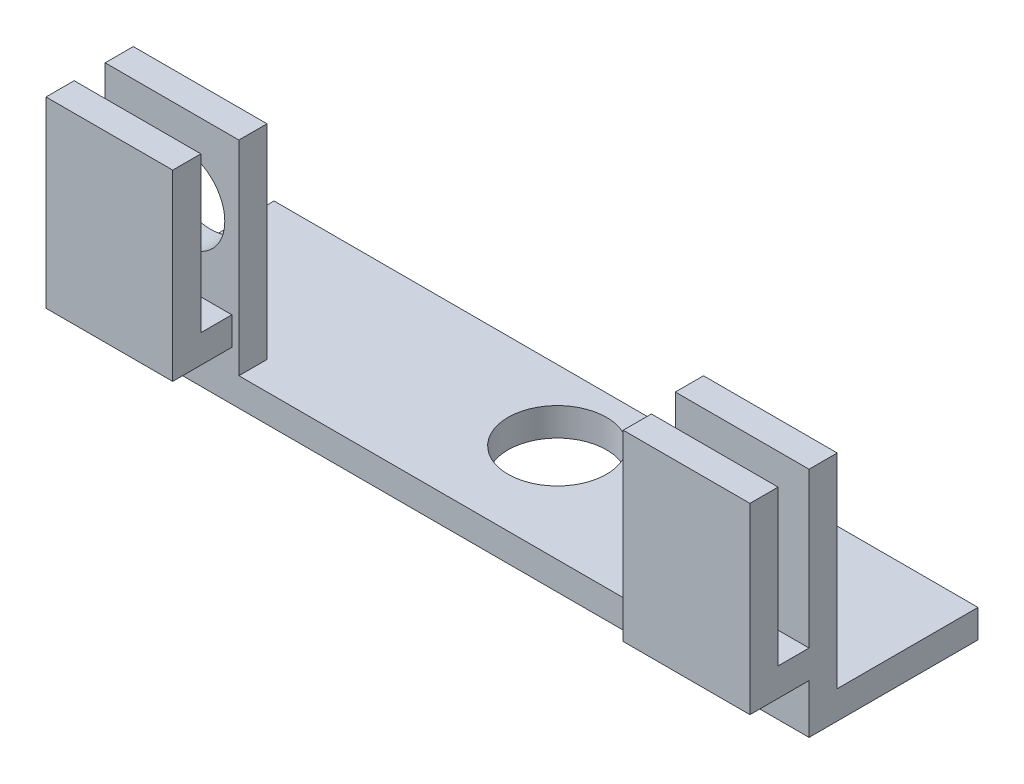
from build123d import *

# Parameters (mm, degrees)
ESBO_O1_R                = 1.5
RESSALTO_EXTRUS_O1_DEPTH = 1
ESBO_O2_W                = 25
ESBO_O2_H                = 1
RESSALTO_EXTRUS_O2_DEPTH = 5
ESBO_O3_R                = 1.75
CORTE_EXTRUS_O1_DEPTH    = 5
ESBO_O4_W                = 4.5
ESBO_O4_H                = 1
RESSALTO_EXTRUS_O3_DEPTH = 1.1
ESBO_O5_W                = 4.5
ESBO_O5_H                = 6.5
RESSALTO_EXTRUS_O4_DEPTH = 1


with BuildPart() as part:
    # Esboço1 → Ressalto-extrusão1 (new body)
    with BuildSketch(Plane.XY):
        Polygon((-2.930659551, 5.581459362), (-2.930659551, -2.668540638), (22.069340449, -2.668540638), (22.069340449, 5.581459362), (17.319340449, 5.581459362), (17.319340449, -1.668540638), (1.819340449, -1.668540638), (1.819340449, 5.581459362), align=None)
        with Locations((-0.180659551, 2.831459362)):
            Circle(ESBO_O1_R, mode=Mode.SUBTRACT)
        with Locations((19.319340449, 2.831459362)):
            Circle(ESBO_O1_R, mode=Mode.SUBTRACT)
    extrude(amount=RESSALTO_EXTRUS_O1_DEPTH)

    # Esboço2 → Ressalto-extrusão2 (add)
    with BuildSketch(Plane(origin=(0, 0, 0), x_dir=(-1, 0, 0), z_dir=(0, 0, -1))):
        with Locations((-9.569340449, -2.168540638)):
            Rectangle(ESBO_O2_W, ESBO_O2_H)
    extrude(amount=RESSALTO_EXTRUS_O2_DEPTH)

    # Esboço3 → Corte-extrusão1 (cut)
    with BuildSketch(Plane(origin=(0, -1.668540638, 0), x_dir=(1, 0, 0), z_dir=(0, 1, 0))):
        with Locations(Location((9.627945133, 2.5, 0), (0, 0, 180))):
            Circle(ESBO_O3_R)
    extrude(amount=-CORTE_EXTRUS_O1_DEPTH, mode=Mode.SUBTRACT)

    # Esboço4 → Ressalto-extrusão3 (add)
    with BuildSketch(Plane.XY.offset(1)):
        with Locations((-0.680659551, -0.418540638)):
            Rectangle(ESBO_O4_W, ESBO_O4_H)
        with Locations((19.819340449, -0.418540638)):
            Rectangle(ESBO_O4_W, ESBO_O4_H)
    extrude(amount=RESSALTO_EXTRUS_O3_DEPTH)

    # Esboço5 → Ressalto-extrusão4 (add)
    with BuildSketch(Plane.XY.offset(2.1)):
        with Locations((-0.680659551, 2.331459362)):
            Rectangle(ESBO_O5_W, ESBO_O5_H)
        with Locations((19.819340449, 2.331459362)):
            Rectangle(ESBO_O5_W, ESBO_O5_H)
    extrude(amount=RESSALTO_EXTRUS_O4_DEPTH)


solid = part.part
